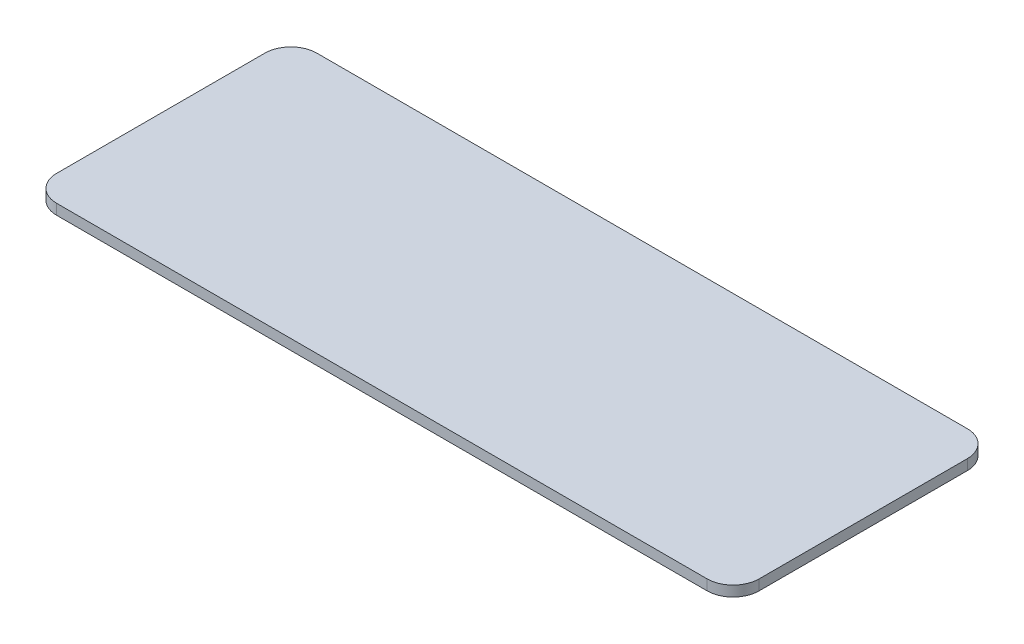
from build123d import *

# Parameters (mm, degrees)
AUFSATZ_LINEAR_AUSTRAGEN1_DEPTH = 1.6


with BuildPart() as part:
    # Skizze1 → Aufsatz-Linear austragen1 (new body)
    with BuildSketch(Plane(origin=(0, 0, 0), x_dir=(1, 0, 0), z_dir=(0, 1, 0))):
        with BuildLine():
            Line((-50, 20), (50, 20))
            ThreePointArc((50, 20), (52.828427125, 18.828427125), (54, 16))
            Line((54, 16), (54, -16))
            ThreePointArc((54, -16), (52.828427125, -18.828427125), (50, -20))
            Line((50, -20), (-50, -20))
            ThreePointArc((-50, -20), (-52.828427125, -18.828427125), (-54, -16))
            Line((-54, -16), (-54, 16))
            ThreePointArc((-54, 16), (-52.828427125, 18.828427125), (-50, 20))
        make_face()
    extrude(amount=AUFSATZ_LINEAR_AUSTRAGEN1_DEPTH)


solid = part.part
